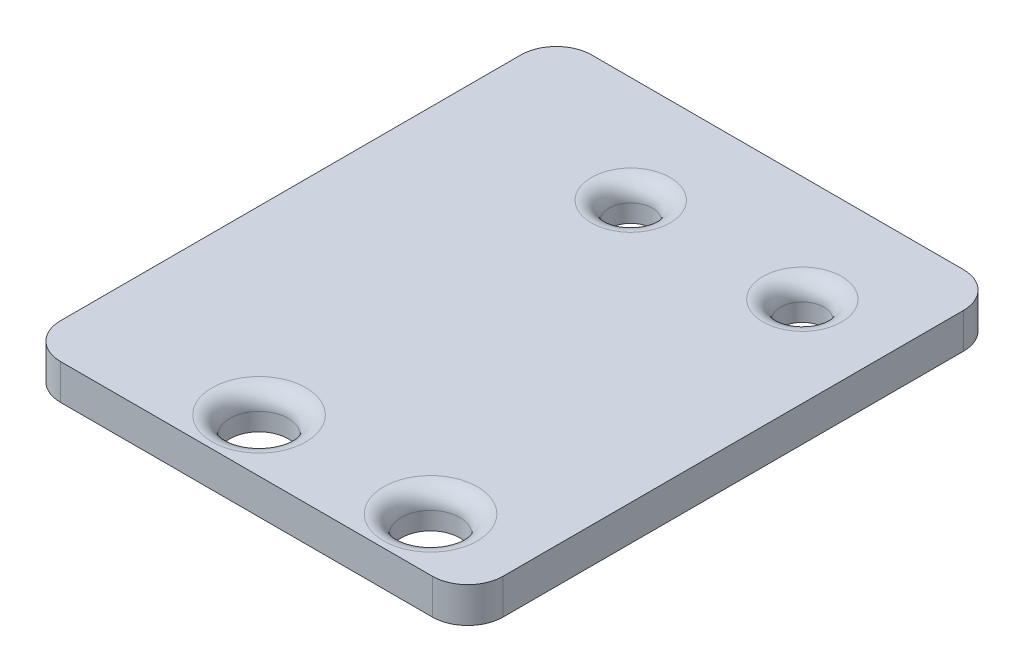
from build123d import *

# Parameters (mm, degrees)
SKETCH2_W           = 25
SKETCH2_H           = 30
SKETCH2_R           = 1.225
SKETCH2_R_2         = 1.65
BOSS_EXTRUDE2_DEPTH = 2
FILLET1_R           = 2
FILLET2_R           = 1


with BuildPart() as part:
    # Sketch2 → Boss-Extrude2 (new body)
    with BuildSketch(Plane(origin=(0, 0, 0), x_dir=(1, 0, 0), z_dir=(0, 1, 0))):
        with Locations((12.5, 15)):
            Rectangle(SKETCH2_W, SKETCH2_H)
        with Locations(Location((19.9, 24, 0), (0, 0, 270))):
            Circle(SKETCH2_R, mode=Mode.SUBTRACT)
        with Locations(Location((10.21, 24, 0), (0, 0, 270))):
            Circle(SKETCH2_R, mode=Mode.SUBTRACT)
        with Locations(Location((10.21, 3, 0), (0, 0, 270))):
            Circle(SKETCH2_R_2, mode=Mode.SUBTRACT)
        with Locations(Location((19.9, 3, 0), (0, 0, 270))):
            Circle(SKETCH2_R_2, mode=Mode.SUBTRACT)
    extrude(amount=BOSS_EXTRUDE2_DEPTH)

    # Fillet1
    fillet1_edges = [part.edges().sort_by_distance(p)[0] for p in [
        (0, 1, -30),
        (25, 1, -30),
        (25, 1, 0),
        (0, 1, 0),
    ]]
    fillet(fillet1_edges, radius=FILLET1_R)

    # Fillet2
    fillet2_edges = [part.edges().sort_by_distance(p)[0] for p in [
        (19.9, 2, -25.225),
        (10.21, 2, -25.225),
        (10.21, 2, -4.65),
        (19.9, 2, -4.65),
    ]]
    fillet(fillet2_edges, radius=FILLET2_R)


solid = part.part
